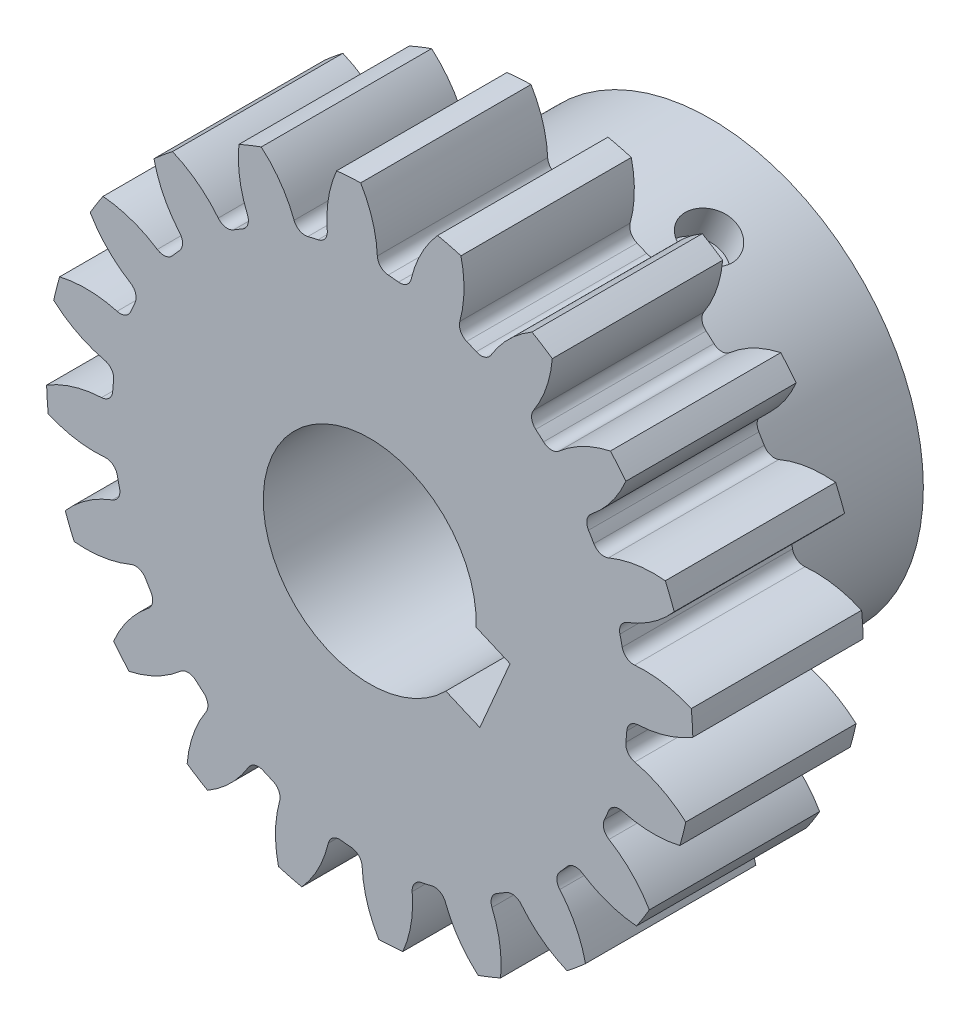
from build123d import *

# Parameters (mm, degrees)
SKETCH3_R          = 18.974533107
GEARBODY_DEPTH     = 10
TOOTHCUT_DEPTH     = 29.636791253
CIRPATTERN1_COUNT  = 20
HUB1DIA_R          = 12.5
HUB1_DEPTH         = 10
BOREDIA_R          = 6.25
BORE_DEPTH         = 12700
KWY1_DEPTH         = 6350
SS1HUB1_D          = 3
SS1HUB1_DEPTH      = 12.5
SS1HUB1_TIP        = 0.901290929
SS3HUB1_D          = 3
SS3HUB1_DEPTH      = 12.5
SS3HUB1_TIP        = 0.901290929
SKETCH4_W          = 6.5
SKETCH4_H          = 10
CUT_EXTRUDE1_DEPTH = 2.5


with BuildPart() as part:
    # Sketch3 → gearBody (new body)
    with BuildSketch(Plane.XY):
        Circle(SKETCH3_R)
    extrude(amount=GEARBODY_DEPTH)

    # Sketch2 → toothCut (cut, through all)
    with BuildSketch(Plane.XY):
        with BuildLine():
            ThreePointArc((15.033981227, -1.691389752), (15.065155037, -1.386540492), (15.090147954, -1.081122364))
            ThreePointArc((15.090147954, -1.081122364), (15.295106791, -0.63996373), (15.741415379, -0.446475464))
            ThreePointArc((15.741415379, -0.446475464), (18.76391608, 0.413855569), (21.083372908, 2.53418573))
            ThreePointArc((21.083372908, 2.53418573), (21.145758619, -1.94617649), (20.266636568, -6.339885859))
            ThreePointArc((20.266636568, -6.339885859), (18.373160621, -3.831813131), (15.558468171, -2.434248685))
            ThreePointArc((15.558468171, -2.434248685), (15.154973857, -2.16254774), (15.033981227, -1.691389752))
        make_face()
    toothcut = extrude(amount=TOOTHCUT_DEPTH, mode=Mode.SUBTRACT)

    # CirPattern1: toothCut ×20 about axis
    cirpattern1_axis = Axis((0, 0, 10), (0, 0, -1))
    for i in range(1, CIRPATTERN1_COUNT):
        add(toothcut.rotate(cirpattern1_axis, i * 360 / CIRPATTERN1_COUNT), mode=Mode.SUBTRACT)

    # hub1Dia → hub1 (add)
    with BuildSketch(Plane(origin=(0, 0, 0), x_dir=(-1, 0, 0), z_dir=(0, 0, -1))):
        Circle(HUB1DIA_R)
    extrude(amount=HUB1_DEPTH)

    # boreDia → bore (cut, symmetric)
    with BuildSketch(Plane.XY):
        Circle(BOREDIA_R)
    extrude(amount=BORE_DEPTH, both=True, mode=Mode.SUBTRACT)

    # kwy1sketch → kwy1 (cut, symmetric)
    with BuildSketch(Plane.XY):
        Polygon((8.238341941, -1.091889216), (6.461383043, -5.226186867), (1.867718985, -3.251788091), (0, 0), (3.644677884, 0.88250956), align=None)
    extrude(amount=KWY1_DEPTH, both=True, mode=Mode.SUBTRACT)

    # ss1Hub1
    with Locations(Plane(origin=(11.484160144, -4.93599694, -5), x_dir=(0.394879755191, 0.918732811507, 0), z_dir=(0.918732811507, -0.394879755191, 0))):
        with Locations((0, 0)):
            Hole(SS1HUB1_D / 2, depth=SS1HUB1_DEPTH)
            with Locations((0, 0, -(SS1HUB1_DEPTH + SS1HUB1_TIP / 2))):  # 118° drill point
                Cone(0, SS1HUB1_D / 2, SS1HUB1_TIP, mode=Mode.SUBTRACT)

    # ss3Hub1
    with Locations(Plane(origin=(4.93599694, 11.484160144, -5), x_dir=(0.918732811507, -0.394879755191, 0), z_dir=(0.394879755191, 0.918732811507, 0))):
        with Locations((0, 0)):
            Hole(SS3HUB1_D / 2, depth=SS3HUB1_DEPTH)
            with Locations((0, 0, -(SS3HUB1_DEPTH + SS3HUB1_TIP / 2))):  # 118° drill point
                Cone(0, SS3HUB1_D / 2, SS3HUB1_TIP, mode=Mode.SUBTRACT)

    # Sketch4 → Cut-Extrude1 (cut)
    with BuildSketch(Plane(origin=(3.139294054, 7.303925851, 0), x_dir=(-0.9187328115073758, 0.39487975519106144, 0), z_dir=(-0.39487975519106144, -0.9187328115073758, 0))):
        with Locations((0, 5)):
            Rectangle(SKETCH4_W, SKETCH4_H)
    extrude(amount=-CUT_EXTRUDE1_DEPTH, mode=Mode.SUBTRACT)


solid = part.part
